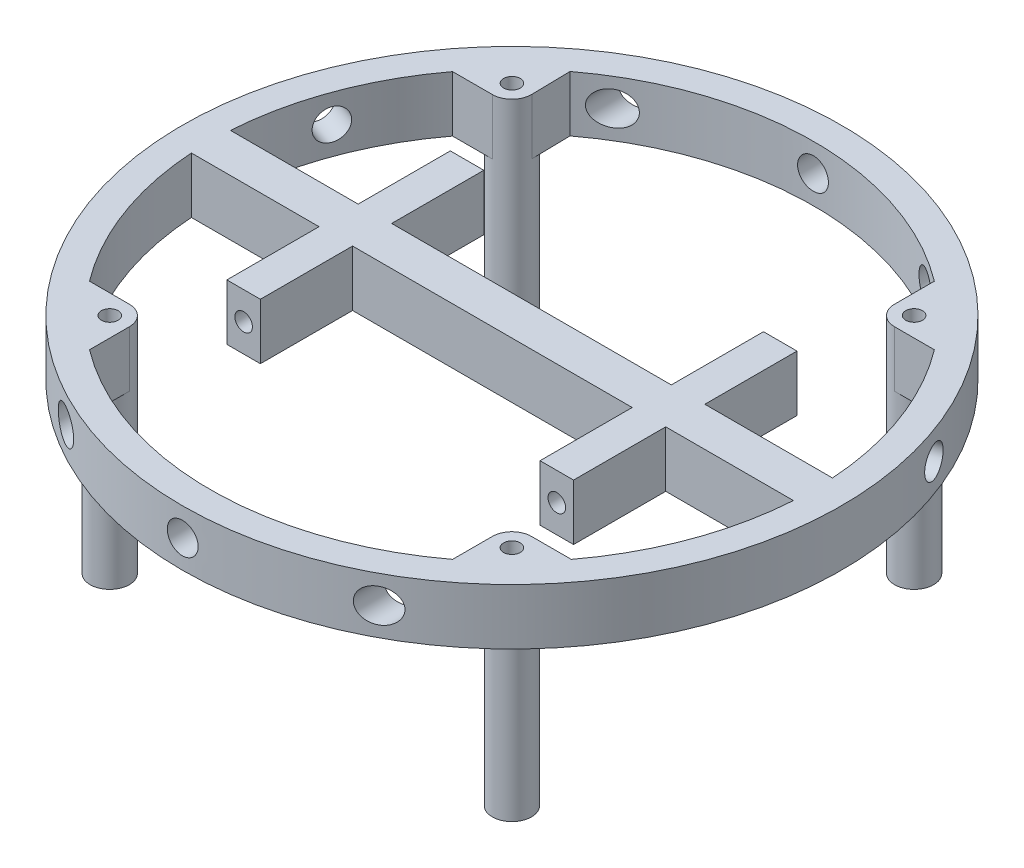
from build123d import *

# Parameters (mm, degrees)
SKETCH1_R                       = 37.465
BOSS_EXTRUDE1_DEPTH             = 6.35
SKETCH2_R                       = 1.25
CUT_EXTRUDE1_DEPTH              = 23.35
SKETCH7_R                       = 1.05
BOSS_EXTRUDE2_DEPTH             = 6.35
SKETCH8_R                       = 1.27
BOSS_EXTRUDE3_DEPTH             = 6.35
BOSS_EXTRUDE4_DEPTH             = 9.525
BOSS_EXTRUDE4_DEPTH_BACK        = 15.875
SKETCH15_W                      = 3.81
SKETCH15_H                      = 6.35
SKETCH15_R                      = 1.25
SKETCH16_R                      = 1.25
SKETCH16_R_2                    = 1
BOSS_EXTRUDE5_DEPTH             = 25.4
BOSS_EXTRUDE6_START             = -14.9225
SKETCH17_R                      = 1.25
SKETCH17_R_2                    = 1
BOSS_EXTRUDE6_DEPTH             = 25.4
BOSS_EXTRUDE7_DEPTH             = 9.525
BOSS_EXTRUDE7_DEPTH_BACK        = 15.875
SKETCH18_W                      = 3.81
SKETCH18_H                      = 6.35
SKETCH18_R                      = 0.9
BOSS_EXTRUDE8_START             = -6.35
SKETCH20_R                      = 1.27
SKETCH20_R_2                    = 1.05
BOSS_EXTRUDE8_DEPTH             = 6.35
BOSS_EXTRUDE9_START             = -25.4
SKETCH21_R                      = 2.2225
SKETCH21_R_2                    = 0.95
BOSS_EXTRUDE9_DEPTH             = 25.4
SKETCH22_R                      = 1.905
CUT_EXTRUDE4_DEPTH              = 37
CUT_EXTRUDE5_START              = 42
SKETCH23_R                      = 1.905
CUT_EXTRUDE5_DEPTH              = 42
SKETCH25_R                      = 1
CUT_EXTRUDE6_DEPTH              = 34
BOSS_EXTRUDE10_START            = -6.35
SKETCH26_R                      = 1.05
SKETCH26_R_2                    = 0.95
BOSS_EXTRUDE10_DEPTH            = 6.35
CUT_EXTRUDE7_START              = 41
SKETCH27_R                      = 1.7526
CUT_EXTRUDE7_DEPTH              = 13
CIRPATTERN4_COUNT               = 2
CIRPATTERN4_ANGLE               = 110
CIRPATTERN4_THE_OTHER_WAY_COUNT = 2
CIRPATTERN4_THE_OTHER_WAY_ANGLE = 110
SKETCH28_R                      = 1.7526
CUT_EXTRUDE8_DEPTH              = 70


with BuildPart() as part:
    # Sketch1 → Boss-Extrude1 (new body)
    with BuildSketch(Plane(origin=(0, 0, 0), x_dir=(1, 0, 0), z_dir=(0, 1, 0))):
        with Locations(Location((-50.758393371, -9.111207685, 0), (0, 0, 270))):
            Circle(SKETCH1_R)
        with BuildLine():
            Line((-16.540494638, -6.888707685), (-84.976292105, -6.888707685))
            ThreePointArc((-84.976292105, -6.888707685), (-50.758393371, 25.178792315), (-16.540494638, -6.888707685))
        make_face(mode=Mode.SUBTRACT)
        with BuildLine():
            Line((-84.976292105, -11.333707685), (-16.540494638, -11.333707685))
            ThreePointArc((-16.540494638, -11.333707685), (-50.758393371, -43.401207685), (-84.976292105, -11.333707685))
        make_face(mode=Mode.SUBTRACT)
    extrude(amount=BOSS_EXTRUDE1_DEPTH)

    # Sketch2 → Cut-Extrude1 (cut)
    with BuildSketch(Plane.XY.offset(17.086207685)):
        with Locations(Location((-68.558393371, 3.175, 0), (0, 0, 180))):
            Circle(SKETCH2_R)
        with Locations(Location((-32.958393371, 3.175, 0), (0, 0, 180))):
            Circle(SKETCH2_R)
    extrude(amount=-CUT_EXTRUDE1_DEPTH, mode=Mode.SUBTRACT)

    # Sketch7 → Boss-Extrude2 (add)
    with BuildSketch(Plane.XZ):
        with BuildLine():
            ThreePointArc((-71.395893371, -13.748792315), (-72.04684855, -12.177247493), (-73.618393371, -11.526292315))
            Line((-73.618393371, -11.526292315), (-78.142653335, -11.526292315))
            ThreePointArc((-78.142653335, -11.526292315), (-75.041380183, -15.099134144), (-71.477846036, -18.211097877))
            Line((-71.477846036, -18.211097877), (-71.395893371, -13.748792315))
        make_face()
        with Locations(Location((-73.618393371, -13.748792315, 0), (0, 0, 270))):
            Circle(SKETCH7_R, mode=Mode.SUBTRACT)
    extrude(amount=-BOSS_EXTRUDE2_DEPTH)

    # Sketch8 → Boss-Extrude3 (add)
    # profile 1 of 3: a face of its own
    with BuildSketch(Plane.XZ):
        with BuildLine():
            Line((-23.374133408, -11.526292315), (-27.898393371, -11.526292315))
            ThreePointArc((-27.898393371, -11.526292315), (-29.469938192, -12.177247493), (-30.120893371, -13.748792315))
            Line((-30.120893371, -13.748792315), (-30.120893371, -18.273052278))
            ThreePointArc((-30.120893371, -18.273052278), (-26.511701844, -15.135483842), (-23.374133408, -11.526292315))
        make_face()
        with Locations(Location((-27.898393371, -13.748792315, 0), (0, 0, 270))):
            Circle(SKETCH8_R, mode=Mode.SUBTRACT)
    # profile 2 of 3: a face of its own
    with BuildSketch(Plane.XZ):
        with BuildLine():
            ThreePointArc((-71.395893371, 36.495467649), (-75.005084898, 33.357899212), (-78.142653335, 29.748707685))
            Line((-78.142653335, 29.748707685), (-73.618393371, 29.748707685))
            ThreePointArc((-73.618393371, 29.748707685), (-72.04684855, 30.399662864), (-71.395893371, 31.971207685))
            Line((-71.395893371, 31.971207685), (-71.395893371, 36.495467649))
        make_face()
        with Locations(Location((-73.618393371, 31.971207685, 0), (0, 0, 270))):
            Circle(SKETCH8_R, mode=Mode.SUBTRACT)
    # profile 3 of 3: a face of its own
    with BuildSketch(Plane.XZ):
        with BuildLine():
            Line((-27.898393371, 29.748707685), (-23.374133408, 29.748707685))
            ThreePointArc((-23.374133408, 29.748707685), (-26.511701844, 33.357899212), (-30.120893371, 36.495467649))
            Line((-30.120893371, 36.495467649), (-30.120893371, 31.971207685))
            ThreePointArc((-30.120893371, 31.971207685), (-29.469938192, 30.399662864), (-27.898393371, 29.748707685))
        make_face()
        with Locations(Location((-27.898393371, 31.971207685, 0), (0, 0, 270))):
            Circle(SKETCH8_R, mode=Mode.SUBTRACT)
    extrude(amount=-BOSS_EXTRUDE3_DEPTH)

    # Sketch15 → Boss-Extrude4 (add, two sides: drawn at the far end of the back side and taken through both)
    with BuildSketch(Plane.XY.offset(12.286207685).offset(-BOSS_EXTRUDE4_DEPTH_BACK)):
        with Locations((-68.558393371, 3.175)):
            Rectangle(SKETCH15_W, SKETCH15_H)
        with Locations((-68.558393371, 3.175)):
            Circle(SKETCH15_R, mode=Mode.SUBTRACT)
    extrude(amount=BOSS_EXTRUDE4_DEPTH + BOSS_EXTRUDE4_DEPTH_BACK)

    # Sketch16 → Boss-Extrude5 (add)
    with BuildSketch(Plane.XY.offset(21.811207685)):
        with Locations((-68.558393371, 3.175)):
            Circle(SKETCH16_R)
        with Locations((-68.558393371, 3.175)):
            Circle(SKETCH16_R_2, mode=Mode.SUBTRACT)
    extrude(amount=-BOSS_EXTRUDE5_DEPTH)

    # Sketch17 → Boss-Extrude6 (add)
    with BuildSketch(Plane.XY.offset(11.333707685).offset(BOSS_EXTRUDE6_START)):
        with Locations(Location((-32.958393371, 3.175, 0), (0, 0, 180))):
            Circle(SKETCH17_R)
        with Locations((-32.958393371, 3.175)):
            Circle(SKETCH17_R_2, mode=Mode.SUBTRACT)
    extrude(amount=BOSS_EXTRUDE6_DEPTH)

    # Sketch18 → Boss-Extrude7 (add, two sides: drawn at the far end of the back side and taken through both)
    with BuildSketch(Plane.XY.offset(12.286207685).offset(-BOSS_EXTRUDE7_DEPTH_BACK)):
        with Locations((-32.958393371, 3.175)):
            Rectangle(SKETCH18_W, SKETCH18_H)
        with Locations((-32.958393371, 3.175)):
            Circle(SKETCH18_R, mode=Mode.SUBTRACT)
    extrude(amount=BOSS_EXTRUDE7_DEPTH + BOSS_EXTRUDE7_DEPTH_BACK)

    # Sketch20 → Boss-Extrude8 (add)
    # profile 1 of 3: a face of its own
    with BuildSketch(Plane(origin=(0, 6.35, 0), x_dir=(1, 0, 0), z_dir=(0, 1, 0)).offset(BOSS_EXTRUDE8_START)):
        with Locations((-73.618393371, -31.971207685)):
            Circle(SKETCH20_R)
        with Locations(Location((-73.618393371, -31.971207685, 0), (0, 0, 270))):
            Circle(SKETCH20_R_2, mode=Mode.SUBTRACT)
    # profile 2 of 3: a face of its own
    with BuildSketch(Plane(origin=(0, 6.35, 0), x_dir=(1, 0, 0), z_dir=(0, 1, 0)).offset(BOSS_EXTRUDE8_START)):
        with Locations((-27.898393371, -31.971207685)):
            Circle(SKETCH20_R)
        with Locations(Location((-27.898393371, -31.971207685, 0), (0, 0, 270))):
            Circle(SKETCH20_R_2, mode=Mode.SUBTRACT)
    # profile 3 of 3: a face of its own
    with BuildSketch(Plane(origin=(0, 6.35, 0), x_dir=(1, 0, 0), z_dir=(0, 1, 0)).offset(BOSS_EXTRUDE8_START)):
        with Locations((-27.898393371, 13.748792315)):
            Circle(SKETCH20_R)
        with Locations(Location((-27.898393371, 13.748792315, 0), (0, 0, 270))):
            Circle(SKETCH20_R_2, mode=Mode.SUBTRACT)
    extrude(amount=BOSS_EXTRUDE8_DEPTH)

    # Sketch21 → Boss-Extrude9 (add)
    # profile 1 of 4: a face of its own
    with BuildSketch(Plane(origin=(0, 6.35, 0), x_dir=(1, 0, 0), z_dir=(0, 1, 0)).offset(BOSS_EXTRUDE9_START)):
        with Locations(Location((-73.618393371, -31.971207685, 0), (0, 0, 90))):
            Circle(SKETCH21_R)
        with Locations(Location((-73.618393371, -31.971207685, 0), (0, 0, 270))):
            Circle(SKETCH21_R_2, mode=Mode.SUBTRACT)
    # profile 2 of 4: a face of its own
    with BuildSketch(Plane(origin=(0, 6.35, 0), x_dir=(1, 0, 0), z_dir=(0, 1, 0)).offset(BOSS_EXTRUDE9_START)):
        with Locations(Location((-27.898393371, -31.971207685, 0), (0, 0, 90))):
            Circle(SKETCH21_R)
        with Locations(Location((-27.898393371, -31.971207685, 0), (0, 0, 270))):
            Circle(SKETCH21_R_2, mode=Mode.SUBTRACT)
    # profile 3 of 4: a face of its own
    with BuildSketch(Plane(origin=(0, 6.35, 0), x_dir=(1, 0, 0), z_dir=(0, 1, 0)).offset(BOSS_EXTRUDE9_START)):
        with Locations(Location((-27.898393371, 13.748792315, 0), (0, 0, 270))):
            Circle(SKETCH21_R)
        with Locations(Location((-27.898393371, 13.748792315, 0), (0, 0, 270))):
            Circle(SKETCH21_R_2, mode=Mode.SUBTRACT)
    # profile 4 of 4: a face of its own
    with BuildSketch(Plane(origin=(0, 6.35, 0), x_dir=(1, 0, 0), z_dir=(0, 1, 0)).offset(BOSS_EXTRUDE9_START)):
        with Locations(Location((-73.618393371, 13.748792315, 0), (0, 0, 270))):
            Circle(SKETCH21_R)
        with Locations(Location((-73.618393371, 13.748792315, 0), (0, 0, 270))):
            Circle(SKETCH21_R_2, mode=Mode.SUBTRACT)
    extrude(amount=BOSS_EXTRUDE9_DEPTH)

    # Sketch22 → Cut-Extrude4 (cut)
    with BuildSketch(Plane(origin=(0, 0, -3.588792315), x_dir=(-1, 0, 0), z_dir=(0, 0, -1))):
        with Locations(Location((32.958393371, 3.175, 0), (0, 0, 180))):
            Circle(SKETCH22_R)
        with Locations(Location((68.558393371, 3.175, 0), (0, 0, 180))):
            Circle(SKETCH22_R)
    extrude(amount=CUT_EXTRUDE4_DEPTH, mode=Mode.SUBTRACT)

    # Sketch23 → Cut-Extrude5 (cut)
    with BuildSketch(Plane.XY.offset(21.811207685).offset(CUT_EXTRUDE5_START)):
        with Locations((-32.958393371, 3.175)):
            Circle(SKETCH23_R)
        with Locations((-68.558393371, 3.175)):
            Circle(SKETCH23_R)
    extrude(amount=-CUT_EXTRUDE5_DEPTH, mode=Mode.SUBTRACT)

    # Sketch25 → Cut-Extrude6 (cut)
    with BuildSketch(Plane.XY.offset(21.811207685)):
        with Locations((-32.958393371, 3.175)):
            Circle(SKETCH25_R)
    extrude(amount=-CUT_EXTRUDE6_DEPTH, mode=Mode.SUBTRACT)

    # Sketch26 → Boss-Extrude10 (add)
    # profile 1 of 4: a face of its own
    with BuildSketch(Plane(origin=(0, 6.35, 0), x_dir=(-1, 0, 0), z_dir=(0, 1, 0)).offset(BOSS_EXTRUDE10_START)):
        with Locations((73.618393371, 31.971207685)):
            Circle(SKETCH26_R)
        with Locations(Location((73.618393371, 31.971207685, 0), (0, 0, 90))):
            Circle(SKETCH26_R_2, mode=Mode.SUBTRACT)
    # profile 2 of 4: a face of its own
    with BuildSketch(Plane(origin=(0, 6.35, 0), x_dir=(-1, 0, 0), z_dir=(0, 1, 0)).offset(BOSS_EXTRUDE10_START)):
        with Locations((27.898393371, 31.971207685)):
            Circle(SKETCH26_R)
        with Locations(Location((27.898393371, 31.971207685, 0), (0, 0, 90))):
            Circle(SKETCH26_R_2, mode=Mode.SUBTRACT)
    # profile 3 of 4: a face of its own
    with BuildSketch(Plane(origin=(0, 6.35, 0), x_dir=(-1, 0, 0), z_dir=(0, 1, 0)).offset(BOSS_EXTRUDE10_START)):
        with Locations((27.898393371, -13.748792315)):
            Circle(SKETCH26_R)
        with Locations(Location((27.898393371, -13.748792315, 0), (0, 0, 90))):
            Circle(SKETCH26_R_2, mode=Mode.SUBTRACT)
    # profile 4 of 4: a face of its own
    with BuildSketch(Plane(origin=(0, 6.35, 0), x_dir=(-1, 0, 0), z_dir=(0, 1, 0)).offset(BOSS_EXTRUDE10_START)):
        with Locations((73.618393371, -13.748792315)):
            Circle(SKETCH26_R)
        with Locations(Location((73.618393371, -13.748792315, 0), (0, 0, 90))):
            Circle(SKETCH26_R_2, mode=Mode.SUBTRACT)
    extrude(amount=BOSS_EXTRUDE10_DEPTH)

    # Sketch27 → Cut-Extrude7 (cut)
    with BuildSketch(Plane(origin=(0, 52.968991226, 0), x_dir=(1, 0, 0), z_dir=(0, 0, 1)).offset(CUT_EXTRUDE7_START)):
        with Locations((-50.758393371, -49.793991226)):
            Circle(SKETCH27_R)
    cut_extrude7 = extrude(amount=CUT_EXTRUDE7_DEPTH, mode=Mode.SUBTRACT)

    # CirPattern4: Cut-Extrude7 ×2 about axis
    cirpattern4_axis = Axis((-50.758393371, 0, 9.111207685), (0, -1, 0))
    for i in range(1, CIRPATTERN4_COUNT):
        add(cut_extrude7.rotate(cirpattern4_axis, i * CIRPATTERN4_ANGLE / (CIRPATTERN4_COUNT - 1)), mode=Mode.SUBTRACT)

    # CirPattern4 the other way: Cut-Extrude7 ×2 about axis
    cirpattern4_the_other_way_axis = Axis((-50.758393371, 0, 9.111207685), (0, 1, 0))
    for i in range(1, CIRPATTERN4_THE_OTHER_WAY_COUNT):
        add(cut_extrude7.rotate(cirpattern4_the_other_way_axis, i * CIRPATTERN4_THE_OTHER_WAY_ANGLE / (CIRPATTERN4_THE_OTHER_WAY_COUNT - 1)), mode=Mode.SUBTRACT)

    # Sketch28 → Cut-Extrude8 (cut)
    with BuildSketch(Plane(origin=(0, 0, 6.888707685), x_dir=(-1, 0, 0), z_dir=(0, 0, -1))):
        with Locations(Location((50.778881538, 3.175, 0), (0, 0, 180))):
            Circle(SKETCH28_R)
    extrude(amount=CUT_EXTRUDE8_DEPTH, mode=Mode.SUBTRACT)


solid = part.part
